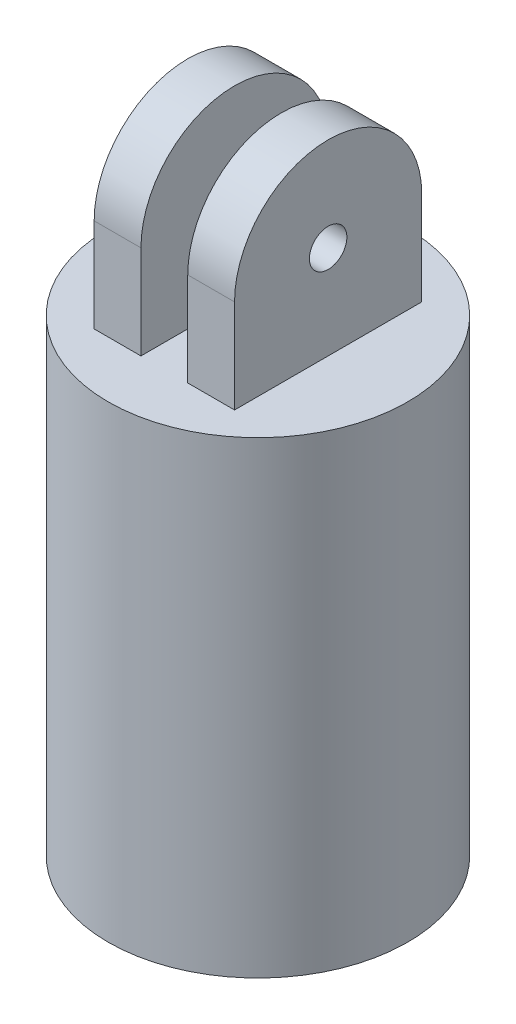
from build123d import *

# Parameters (mm, degrees)
SKETCH1_R               = 16
SKETCH1_R_2             = 12.7
BOSS_EXTRUDE1_DEPTH     = 40
SKETCH2_R               = 16
BOSS_EXTRUDE2_DEPTH     = 10
SKETCH3_W               = 5
SKETCH3_H               = 20
BOSS_EXTRUDE3_DEPTH     = 20
CUT_EXTRUDE1_DEPTH      = 15
CUT_EXTRUDE1_DEPTH_BACK = 5


with BuildPart() as part:
    # Sketch1 → Boss-Extrude1 (new body)
    with BuildSketch(Plane(origin=(0, 0, 0), x_dir=(1, 0, 0), z_dir=(0, 1, 0))):
        with Locations(Location((0, 0, 0), (0, 0, 270))):
            Circle(SKETCH1_R)
        with Locations(Location((0, 0, 0), (0, 0, 270))):
            Circle(SKETCH1_R_2, mode=Mode.SUBTRACT)
    extrude(amount=BOSS_EXTRUDE1_DEPTH)

    # Sketch2 → Boss-Extrude2 (add)
    with BuildSketch(Plane(origin=(0, 40, 0), x_dir=(1, 0, 0), z_dir=(0, 1, 0))):
        with Locations(Location((0, 0, 0), (0, 0, 270))):
            Circle(SKETCH2_R)
    extrude(amount=BOSS_EXTRUDE2_DEPTH)

    # Sketch3 → Boss-Extrude3 (add)
    with BuildSketch(Plane(origin=(0, 50, 0), x_dir=(1, 0, 0), z_dir=(0, 1, 0))):
        with Locations((-5, 0)):
            Rectangle(SKETCH3_W, SKETCH3_H)
        with Locations((5, 0)):
            Rectangle(SKETCH3_W, SKETCH3_H)
    extrude(amount=BOSS_EXTRUDE3_DEPTH)

    # Sketch4 → Cut-Extrude1 (cut, two sides: drawn at the far end of the back side and taken through both)
    with BuildSketch(Plane.ZY.offset(-2.5).offset(-CUT_EXTRUDE1_DEPTH_BACK)):
        with BuildLine():
            Line((0, 70), (-10, 70))
            Line((-10, 70), (-10, 60))
            ThreePointArc((-10, 60), (-7.071067812, 67.071067812), (0, 70))
        make_face()
        with BuildLine():
            Line((10, 70), (0, 70))
            ThreePointArc((0, 70), (7.071067812, 67.071067812), (10, 60))
            Line((10, 60), (10, 70))
        make_face()
        with BuildLine():
            Line((0, 58), (0, 62))
            ThreePointArc((0, 62), (-2, 60), (0, 58))
        make_face()
        with BuildLine():
            ThreePointArc((2, 60), (1.414213562, 61.414213562), (0, 62))
            Line((0, 62), (0, 58))
            ThreePointArc((0, 58), (1.414213562, 58.585786438), (2, 60))
        make_face()
    extrude(amount=CUT_EXTRUDE1_DEPTH + CUT_EXTRUDE1_DEPTH_BACK, mode=Mode.SUBTRACT)


solid = part.part
